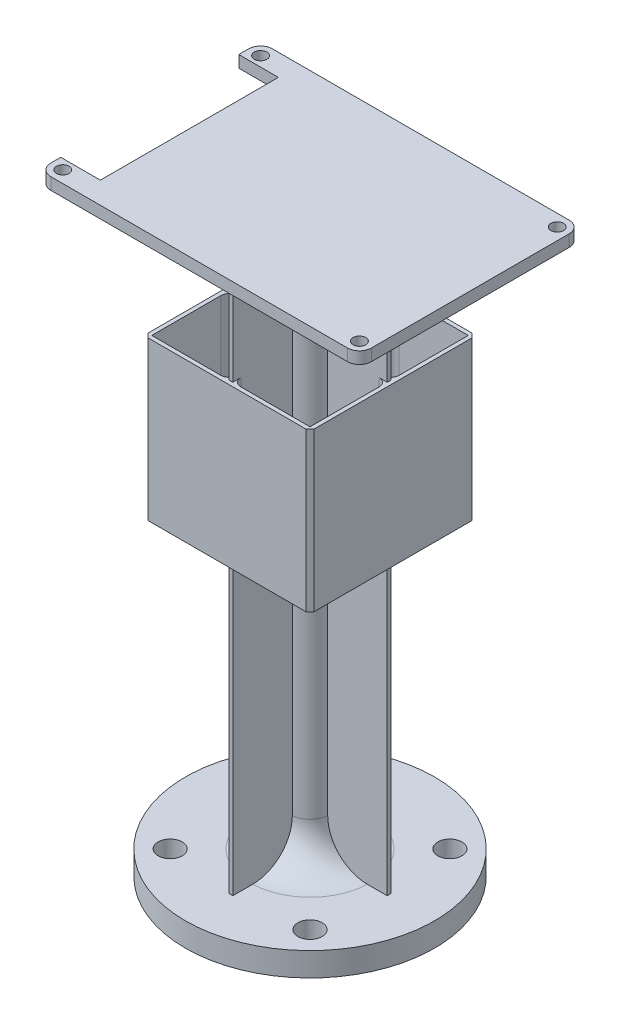
from build123d import *

# Parameters (mm, degrees)
SKETCH_1_R               = 31.5
SKETCH_1_R_2             = 3.05
EXTRUDE_3_DEPTH          = 6
SKETCH_4_R               = 5
EXTRUDE_5_DEPTH          = 145.4
SKETCH_8_W               = 20
SKETCH_8_H               = 145.4
EXTRUDE_8_DEPTH          = 0.5
PATTERN_CIRCULAR_1_COUNT = 4
FILLET_1_R               = 10
EXTRUDE_10_DEPTH         = 3
SKETCH_11_R              = 1.6
CUT_EXTRUDE_1_DEPTH      = 3
SKETCH_12_W              = 10
SKETCH_12_H              = 45
CUT_EXTRUDE_2_DEPTH      = 3
FILLET_3_R               = 10
SKETCH_18_W              = 40
SKETCH_18_H              = 40
EXTRUDE_18_DEPTH         = 70
SKETCH_19_W              = 42
SKETCH_19_H              = 27
CUT_EXTRUDE_3_DEPTH      = 1
SKETCH_20_W              = 42
SKETCH_20_H              = 27
CUT_EXTRUDE_4_DEPTH      = 1
SKETCH_21_W              = 42
SKETCH_21_H              = 27
CUT_EXTRUDE_5_DEPTH      = 1
SKETCH_22_W              = 41
SKETCH_22_H              = 27
CUT_EXTRUDE_6_DEPTH      = 1
FILLET_4_R               = 2


with BuildPart() as part:
    # 草图1 → 凸台-拉伸3 (new body)
    with BuildSketch(Plane(origin=(0, 0, 0), x_dir=(1, 0, 0), z_dir=(0, 1, 0))):
        with Locations(Location((0, 0, 0), (0, 0, 270))):
            Circle(SKETCH_1_R)
        with Locations(Location((-17.67766953, 17.67766953, 0), (0, 0, 270))):
            Circle(SKETCH_1_R_2, mode=Mode.SUBTRACT)
        with Locations(Location((17.67766953, 17.67766953, 0), (0, 0, 270))):
            Circle(SKETCH_1_R_2, mode=Mode.SUBTRACT)
        with Locations(Location((-17.67766953, -17.67766953, 0), (0, 0, 270))):
            Circle(SKETCH_1_R_2, mode=Mode.SUBTRACT)
        with Locations(Location((17.67766953, -17.67766953, 0), (0, 0, 270))):
            Circle(SKETCH_1_R_2, mode=Mode.SUBTRACT)
    extrude(amount=EXTRUDE_3_DEPTH)

    # 草图4 → 凸台-拉伸5 (add)
    with BuildSketch(Plane.XZ):
        with Locations(Location((0, 0, 0), (0, 0, 270))):
            Circle(SKETCH_4_R)
    extrude(amount=-EXTRUDE_5_DEPTH)

    # 草图8 → 凸台-拉伸8 (add, symmetric)
    with BuildSketch(Plane(origin=(0, 0, 0), x_dir=(0, 0, -1), z_dir=(1, 0, 0))):
        with Locations((10, 72.7)):
            Rectangle(SKETCH_8_W, SKETCH_8_H)
    extrude_8 = extrude(amount=EXTRUDE_8_DEPTH, both=True)

    # 阵列(圆周)1: 凸台-拉伸8 ×4 about axis
    pattern_circular_1_axis = Axis((0, 0, 0), (0, 1, 0))
    for i in range(1, PATTERN_CIRCULAR_1_COUNT):
        add(extrude_8.rotate(pattern_circular_1_axis, i * 360 / PATTERN_CIRCULAR_1_COUNT))

    # 圆角1
    fillet_1_edges = [part.edges().sort_by_distance(p)[0] for p in [
        (-3.535533906, 6, -3.535533906),
        (-3.535533906, 6, 3.535533906),
        (3.535533906, 6, 3.535533906),
        (3.535533906, 6, -3.535533906),
    ]]
    fillet(fillet_1_edges, radius=FILLET_1_R)

    # 草图10 → 凸台-拉伸10 (add)
    with BuildSketch(Plane(origin=(0, 145.4, 0), x_dir=(1, 0, 0), z_dir=(0, 1, 0))):
        with BuildLine():
            Line((-37.499452899, -27.999452899), (37.499452899, -27.999452899))
            ThreePointArc((37.499452899, -27.999452899), (39.620773242, -27.120773242), (40.499452899, -24.999452899))
            Line((40.499452899, -24.999452899), (40.499452899, 24.999452899))
            ThreePointArc((40.499452899, 24.999452899), (39.620773242, 27.120773242), (37.499452899, 27.999452899))
            Line((37.499452899, 27.999452899), (-37.499452899, 27.999452899))
            ThreePointArc((-37.499452899, 27.999452899), (-39.620773242, 27.120773242), (-40.499452899, 24.999452899))
            Line((-40.499452899, 24.999452899), (-40.499452899, -24.999452899))
            ThreePointArc((-40.499452899, -24.999452899), (-39.620773242, -27.120773242), (-37.499452899, -27.999452899))
        make_face()
    extrude(amount=EXTRUDE_10_DEPTH)

    # 草图11 → 切除-拉伸1 (cut)
    with BuildSketch(Plane(origin=(0, 148.4, 0), x_dir=(1, 0, 0), z_dir=(0, 1, 0))):
        with Locations(Location((-37.499452899, 24.999452899, 0), (0, 0, 270))):
            Circle(SKETCH_11_R)
        with Locations(Location((-37.499452899, -24.999452899, 0), (0, 0, 270))):
            Circle(SKETCH_11_R)
        with Locations(Location((37.499452899, 24.999452899, 0), (0, 0, 270))):
            Circle(SKETCH_11_R)
        with Locations(Location((37.499452899, -24.999452899, 0), (0, 0, 270))):
            Circle(SKETCH_11_R)
    extrude(amount=-CUT_EXTRUDE_1_DEPTH, mode=Mode.SUBTRACT)

    # 草图12 → 切除-拉伸2 (cut)
    with BuildSketch(Plane(origin=(0, 148.4, 0), x_dir=(1, 0, 0), z_dir=(0, 1, 0))):
        with Locations((-35.499452899, 0)):
            Rectangle(SKETCH_12_W, SKETCH_12_H)
    extrude(amount=-CUT_EXTRUDE_2_DEPTH, mode=Mode.SUBTRACT)

    # 圆角3
    fillet_3_edges = [part.edges().sort_by_distance(p)[0] for p in [
        (3.535533906, 145.4, -3.535533906),
        (3.535533906, 145.4, 3.535533906),
        (-3.535533906, 145.4, 3.535533906),
        (-3.535533906, 145.4, -3.535533906),
    ]]
    fillet(fillet_3_edges, radius=FILLET_3_R)

    # 草图18 → 凸台-拉伸18 (add)
    with BuildSketch(Plane(origin=(0, 148.4, 0), x_dir=(1, 0, 0), z_dir=(0, 1, 0))):
        Polygon((-20, 21), (-21, 20), (-21, -20), (-20, -21), (20, -21), (21, -20), (21, 20), (20, 21), align=None)
        Rectangle(SKETCH_18_W, SKETCH_18_H, mode=Mode.SUBTRACT)
    extrude(amount=-EXTRUDE_18_DEPTH)

    # 草图19 → 切除-拉伸3 (cut)
    with BuildSketch(Plane(origin=(21, 0, 0), x_dir=(0, 0, -1), z_dir=(1, 0, 0))):
        with Locations((0, 131.9)):
            Rectangle(SKETCH_19_W, SKETCH_19_H)
    extrude(amount=-CUT_EXTRUDE_3_DEPTH, mode=Mode.SUBTRACT)

    # 草图20 → 切除-拉伸4 (cut)
    with BuildSketch(Plane(origin=(0, 0, -21), x_dir=(-1, 0, 0), z_dir=(0, 0, -1))):
        with Locations((0, 131.9)):
            Rectangle(SKETCH_20_W, SKETCH_20_H)
    extrude(amount=-CUT_EXTRUDE_4_DEPTH, mode=Mode.SUBTRACT)

    # 草图21 → 切除-拉伸5 (cut)
    with BuildSketch(Plane.ZY.offset(21)):
        with Locations((0, 131.9)):
            Rectangle(SKETCH_21_W, SKETCH_21_H)
    extrude(amount=-CUT_EXTRUDE_5_DEPTH, mode=Mode.SUBTRACT)

    # 草图22 → 切除-拉伸6 (cut)
    with BuildSketch(Plane.XY.offset(21)):
        with Locations((-0.5, 131.9)):
            Rectangle(SKETCH_22_W, SKETCH_22_H)
    extrude(amount=-CUT_EXTRUDE_6_DEPTH, mode=Mode.SUBTRACT)

    # 圆角4
    fillet_4_edges = [part.edges().sort_by_distance(p)[0] for p in [
        (20, 98.4, -0.5),
        (20, 98.4, 0.5),
        (0.5, 98.4, -20),
        (-0.5, 98.4, -20),
        (-20, 98.4, -0.5),
        (-20, 98.4, 0.5),
        (-0.5, 98.4, 20),
        (0.5, 98.4, 20),
    ]]
    fillet(fillet_4_edges, radius=FILLET_4_R)


solid = part.part
